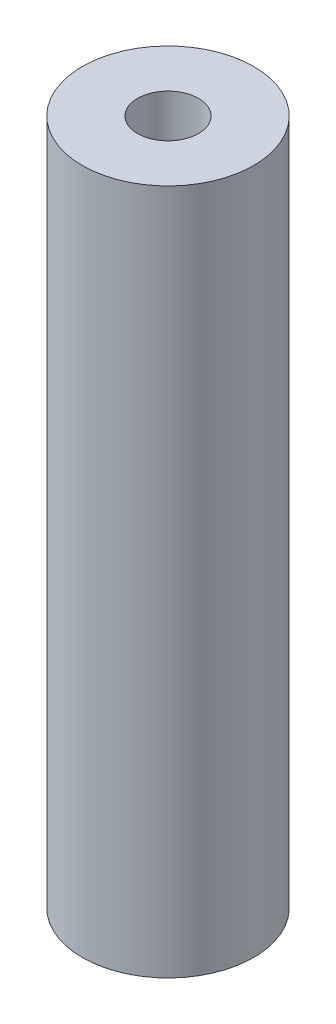
from build123d import *

# Parameters (mm, degrees)
SKETCH1_R            = 4.5
BOSS_EXTRUDE1_DEPTH  = 18
M3_CLEARANCE_HOLE1_D = 3.2


with BuildPart() as part:
    # Sketch1 → Boss-Extrude1 (new, symmetric)
    with BuildSketch(Plane(origin=(0, 0, 0), x_dir=(1, 0, 0), z_dir=(0, 1, 0))):
        with Locations(Location((0, 0, 0), (0, 0, 270))):
            Circle(SKETCH1_R)
    extrude(amount=BOSS_EXTRUDE1_DEPTH, both=True)

    # M3 Clearance Hole1 (through all)
    with Locations(Plane(origin=(0, 18, 0), x_dir=(1, 0, 0), z_dir=(0, 1, 0))):
        with Locations((0, 0)):
            Hole(M3_CLEARANCE_HOLE1_D / 2)


solid = part.part
